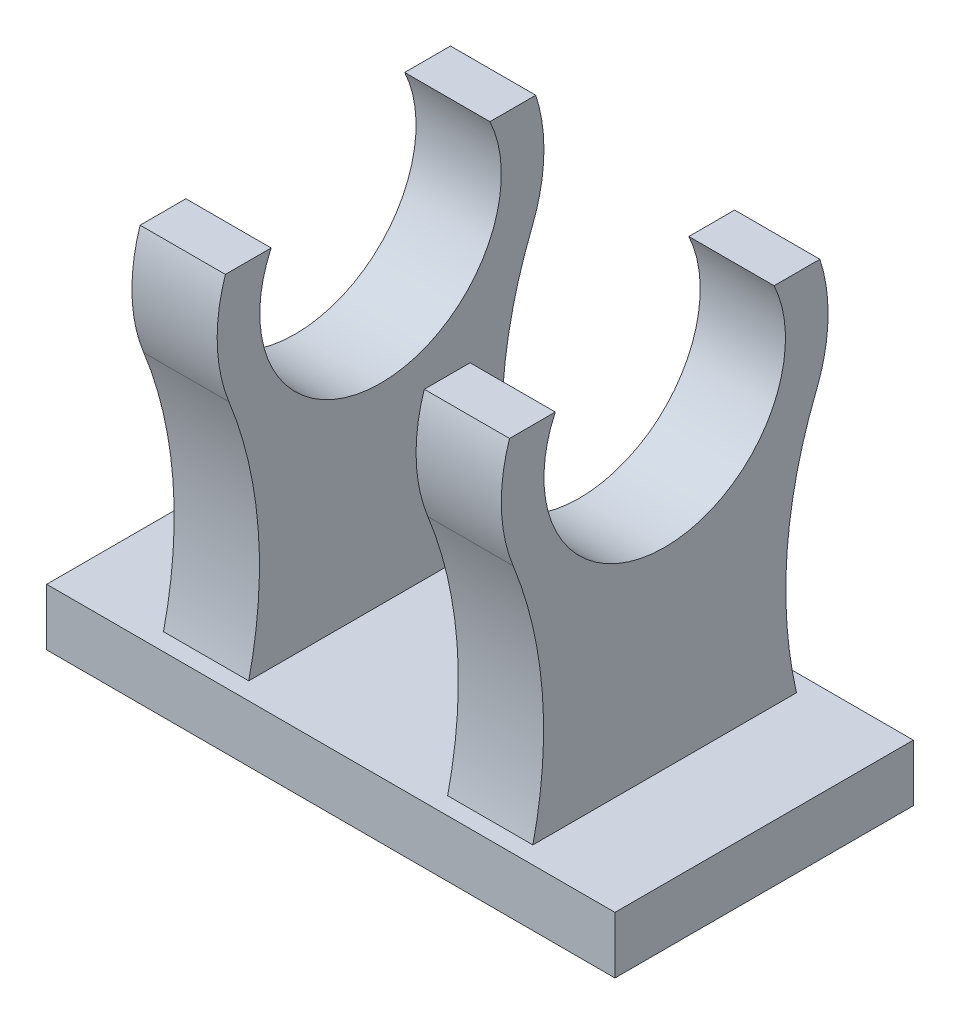
from build123d import *

# Parameters (mm, degrees)
BOSS_EXTRUDE1_DEPTH      = 1.5
BOSS_EXTRUDE1_DEPTH_BACK = 1.5
SKETCH3_W                = 10
SKETCH3_H                = 10.5
BOSS_EXTRUDE2_DEPTH      = 2


with BuildPart() as part:
    # Sketch1 → Boss-Extrude1 (new, two sides: drawn at the far end of the back side and taken through both)
    with BuildSketch(Plane(origin=(0, 0, 0), x_dir=(0, 0, -1), z_dir=(1, 0, 0)).offset(-BOSS_EXTRUDE1_DEPTH_BACK)):
        with BuildLine():
            Line((-5.460998077, 14.8), (-3.85, 14.8))
            ThreePointArc((-3.85, 14.8), (0, 8.75), (3.85, 14.8))
            Line((3.85, 14.8), (5.460998077, 14.8))
            ThreePointArc((5.460998077, 14.8), (5.747028676, 12.815171978), (5.334054451, 10.852824386))
            ThreePointArc((5.334054451, 10.852824386), (4.262621587, 5.434384876), (5.25, 0))
            Line((5.25, 0), (-5.25, 0))
            ThreePointArc((-5.25, 0), (-4.262621587, 5.434384876), (-5.334054451, 10.852824386))
            ThreePointArc((-5.334054451, 10.852824386), (-5.747028676, 12.815171978), (-5.460998077, 14.8))
        make_face()
    extrude(amount=BOSS_EXTRUDE1_DEPTH + BOSS_EXTRUDE1_DEPTH_BACK)

    # Sketch3 → Boss-Extrude2 (add)
    with BuildSketch(Plane.XZ):
        Rectangle(SKETCH3_W, SKETCH3_H)
    extrude(amount=-BOSS_EXTRUDE2_DEPTH)

    # Mirror1: part across plane


with BuildPart() as part_1:
    add(part.part)
    add(part.part.mirror(Plane(origin=(5, 2, -5.25), x_dir=(0, 0, 1), z_dir=(1, 0, 0))))


solid = part_1.part
